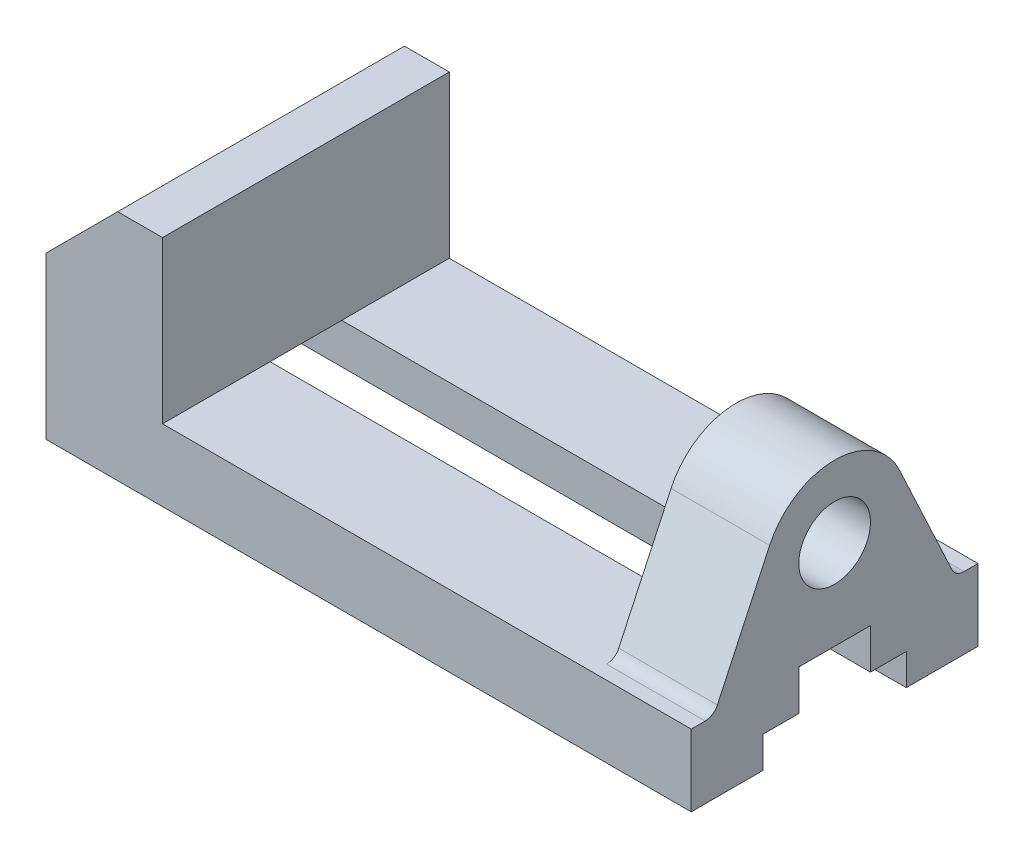
from build123d import *

# Parameters (mm, degrees)
EXTRUDE1_DEPTH               = 64
EXTRUDE2_DEPTH               = 166.939748102
SKETCH3_R                    = 8
EXTRUDE9_DEPTH               = 22
F_6_0_6_DIAMETER_HOLE1_D     = 6
F_6_0_6_DIAMETER_HOLE1_DEPTH = 10
F_6_0_6_DIAMETER_HOLE1_TIP   = 1.802581857


with BuildPart() as part:
    # Sketch1 → Extrude1 (new body)
    with BuildSketch(Plane.XY):
        Polygon((0, 0), (144, 0), (144, 52), (122, 52), (122, 16), (26, 16), (26, 52), (16, 52), (0, 36), align=None)
    extrude(amount=-EXTRUDE1_DEPTH)

    # Sketch2 → Extrude2 (cut, through all)
    with BuildSketch(Plane(origin=(144, 0, 0), x_dir=(0, 0, -1), z_dir=(1, 0, 0))):
        Polygon((16, 0), (48, 0), (48, 7), (40, 7), (40, 16), (24, 16), (24, 7), (16, 7), align=None)
    extrude(amount=-EXTRUDE2_DEPTH, mode=Mode.SUBTRACT)

    # Sketch3 → Extrude9 (cut)
    with BuildSketch(Plane(origin=(144, 0, 0), x_dir=(0, 0, -1), z_dir=(1, 0, 0))):
        with BuildLine():
            Line((5.827512712, 17.732145215), (17.499075407, 42.761892188))
            ThreePointArc((17.499075407, 42.761892188), (23.403206266, 49.494263133), (32, 52))
            Line((32, 52), (0, 52))
            Line((0, 52), (0, 16))
            Line((0, 16), (3.108589351, 16))
            ThreePointArc((3.108589351, 16), (4.720488176, 16.469825663), (5.827512712, 17.732145215))
        make_face()
        with BuildLine():
            Line((64, 52), (32, 52))
            ThreePointArc((32, 52), (40.596793734, 49.494263133), (46.500924593, 42.761892188))
            Line((46.500924593, 42.761892188), (58.172487288, 17.732145215))
            ThreePointArc((58.172487288, 17.732145215), (59.279511824, 16.469825663), (60.891410649, 16))
            Line((60.891410649, 16), (64, 16))
            Line((64, 16), (64, 52))
        make_face()
        with Locations((32, 36)):
            Circle(SKETCH3_R)
    extrude(amount=-EXTRUDE9_DEPTH, mode=Mode.SUBTRACT)

    # Ø6.0 (6) Diameter Hole1
    with Locations(Plane(origin=(38, 0, -10), x_dir=(0, 0, -1), z_dir=(0, -1, 0))):
        with Locations((0, 0), (0, 70), (44, 70), (44, 0)):
            Hole(F_6_0_6_DIAMETER_HOLE1_D / 2, depth=F_6_0_6_DIAMETER_HOLE1_DEPTH)
            with Locations((0, 0, -(F_6_0_6_DIAMETER_HOLE1_DEPTH + F_6_0_6_DIAMETER_HOLE1_TIP / 2))):  # 118° drill point
                Cone(0, F_6_0_6_DIAMETER_HOLE1_D / 2, F_6_0_6_DIAMETER_HOLE1_TIP, mode=Mode.SUBTRACT)


solid = part.part
